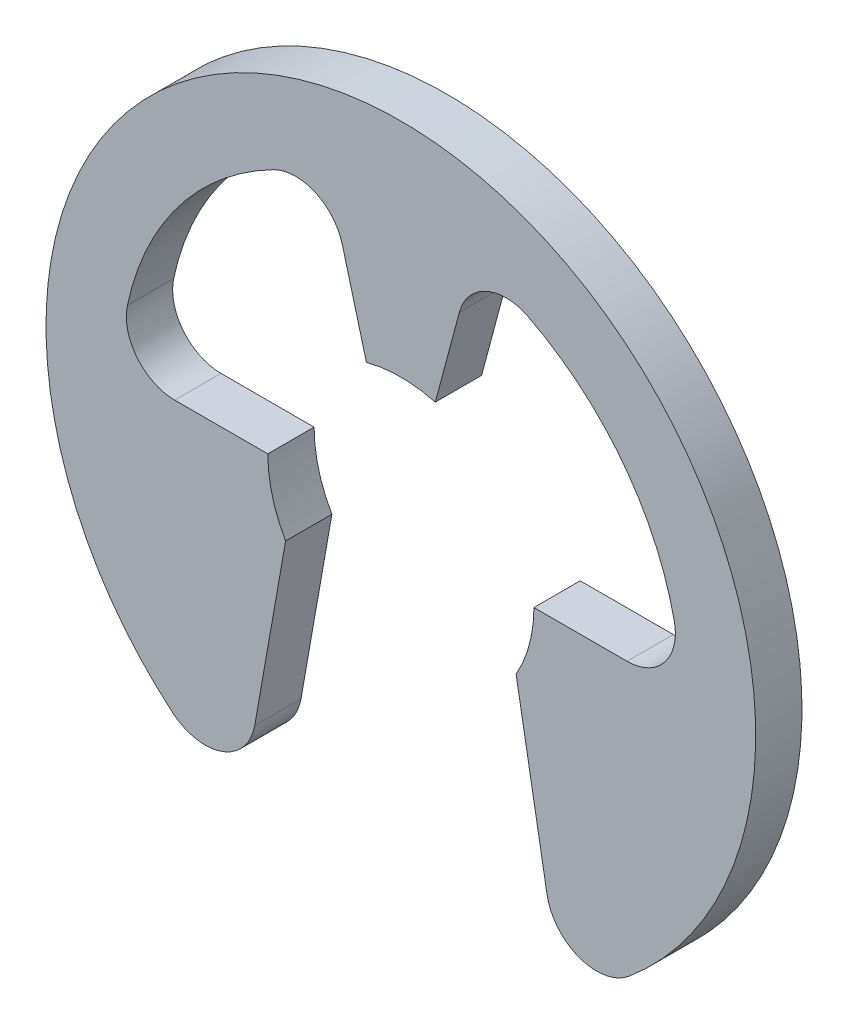
from build123d import *

# Parameters (mm, degrees)
BODY_DEPTH = 0.4


with BuildPart() as part:
    # BodySke → Body (new body)
    with BuildSketch(Plane.XY):
        with BuildLine():
            Line((0.995929214, -0.575), (1.263165111, -2.090570081))
            ThreePointArc((1.263165111, -2.090570081), (1.54317705, -2.424210794), (1.972109934, -2.348452012))
            ThreePointArc((1.972109934, -2.348452012), (0, 3.066666667), (-1.972109934, -2.348452012))
            ThreePointArc((-1.972109934, -2.348452012), (-1.54317705, -2.424210794), (-1.263165111, -2.090570081))
            Line((-1.263165111, -2.090570081), (-0.995929214, -0.575))
            ThreePointArc((-0.995929214, -0.575), (-1.1108147, -0.297641902), (-1.15, 0))
            Line((-1.15, 0), (-1.954467816, 0))
            ThreePointArc((-1.954467816, 0), (-2.279479875, 0.155148024), (-2.363224094, 0.50542028))
            ThreePointArc((-2.363224094, 0.50542028), (-1.917270572, 1.471173453), (-1.099845905, 2.151886791))
            ThreePointArc((-1.099845905, 2.151886791), (-0.739834288, 2.161653219), (-0.505853494, 1.88787094))
            Line((-0.505853494, 1.88787094), (-0.297641902, 1.1108147))
            ThreePointArc((-0.297641902, 1.1108147), (0, 1.15), (0.297641902, 1.1108147))
            Line((0.297641902, 1.1108147), (0.505853494, 1.88787094))
            ThreePointArc((0.505853494, 1.88787094), (0.739834288, 2.161653219), (1.099845905, 2.151886791))
            ThreePointArc((1.099845905, 2.151886791), (1.917270572, 1.471173453), (2.363224094, 0.50542028))
            ThreePointArc((2.363224094, 0.50542028), (2.279479875, 0.155148024), (1.954467816, 0))
            Line((1.954467816, 0), (1.15, 0))
            ThreePointArc((1.15, 0), (1.1108147, -0.297641902), (0.995929214, -0.575))
        make_face()
    extrude(amount=-BODY_DEPTH)


solid = part.part
